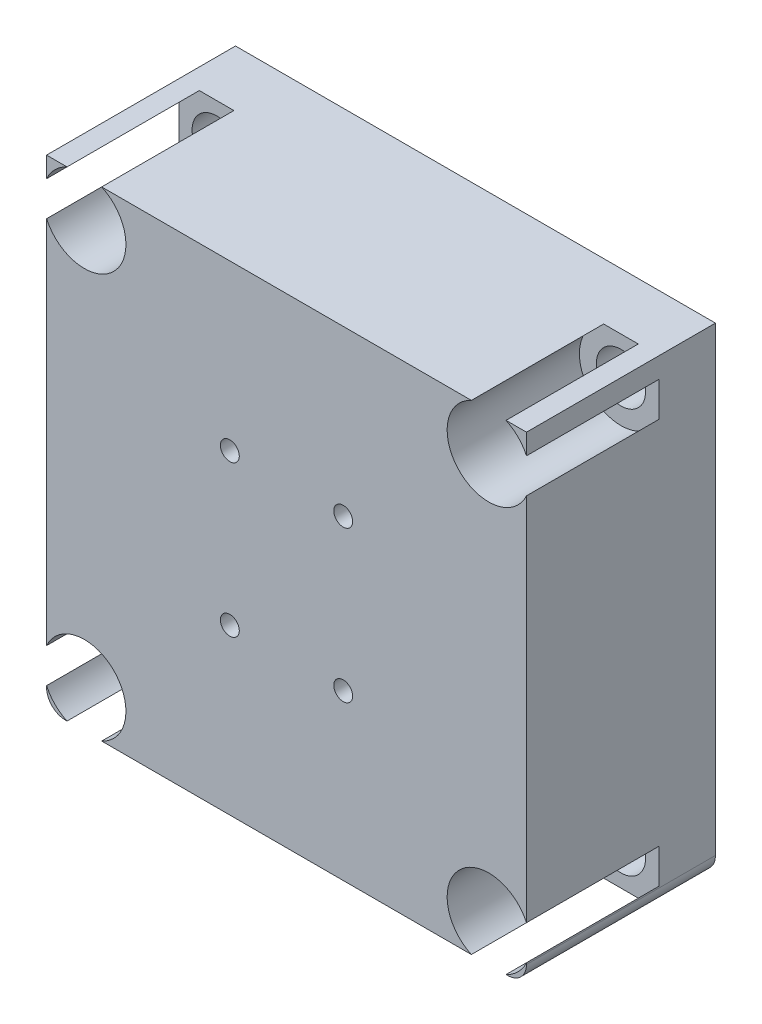
from build123d import *

# Parameters (mm, degrees)
BOSS_EXTRUDE1_DEPTH            = 10
F_1_0MM_DOWEL_HOLE1_D          = 1
CBORE_FOR_M2_SHCS1_D           = 2.6
CBORE_FOR_M2_SHCS1_CBORE_D     = 4.4
CBORE_FOR_M2_SHCS1_CBORE_DEPTH = 7


with BuildPart() as part:
    # Sketch1 → Boss-Extrude1 (new body)
    with BuildSketch(Plane.XY):
        with BuildLine():
            Line((-12.7, 12.7), (-12.7, -11.7))
            ThreePointArc((-12.7, -11.7), (-12.407106781, -12.407106781), (-11.7, -12.7))
            Line((-11.7, -12.7), (11.7, -12.7))
            ThreePointArc((11.7, -12.7), (12.407106781, -12.407106781), (12.7, -11.7))
            Line((12.7, -11.7), (12.7, 12.7))
            Line((12.7, 12.7), (-12.7, 12.7))
        make_face()
    extrude(amount=BOSS_EXTRUDE1_DEPTH)

    # Ø1.0mm Dowel Hole1 (through all)
    with Locations(Plane.XY.offset(10)):
        with Locations((3, -4), (-3, -4), (-3, 4), (3, 4)):
            Hole(F_1_0MM_DOWEL_HOLE1_D / 2)

    # CBORE for M2 SHCS1 (through all)
    with Locations(Plane.XY.offset(10)):
        with Locations((10.7, -10.7), (-10.7, -10.7), (-10.7, 10.7), (10.7, 10.7)):
            CounterBoreHole(CBORE_FOR_M2_SHCS1_D / 2, CBORE_FOR_M2_SHCS1_CBORE_D / 2, CBORE_FOR_M2_SHCS1_CBORE_DEPTH)


solid = part.part
